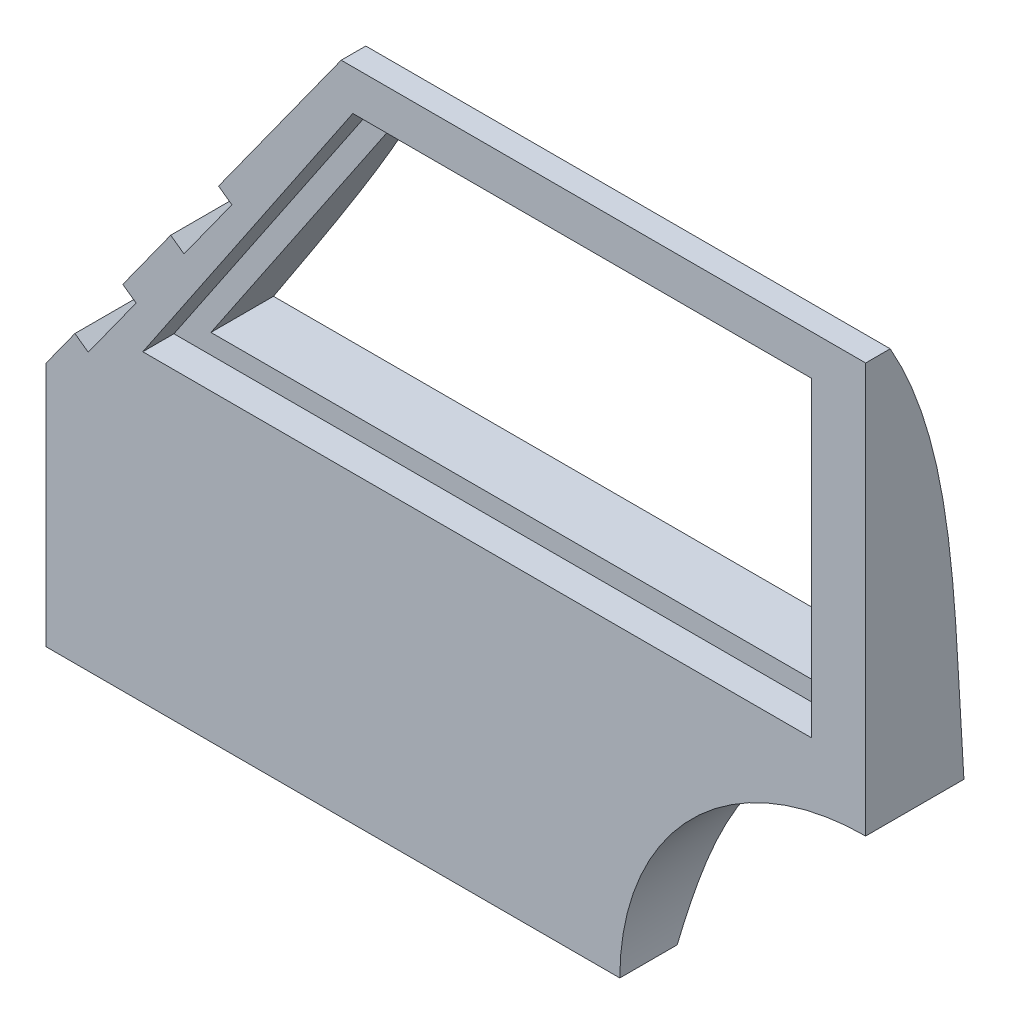
from build123d import *

# Parameters (mm, degrees)
BOSS_EXTRUDE1_DEPTH     = 152.4
CUT_EXTRUDE1_DEPTH      = 1634.518215387
CUT_EXTRUDE1_DEPTH_BACK = 1634.518215387
CUT_EXTRUDE2_DEPTH      = 1634.518215536
FILLET1_R               = 50.8
CUT_EXTRUDE3_DEPTH      = 48.26
CUT_EXTRUDE4_DEPTH      = 1213.010253568
SKETCH6_W               = 101.6
SKETCH6_H               = 127
CUT_EXTRUDE5_DEPTH      = 25.4
LPATTERN1_COUNT         = 2
LPATTERN1_PITCH         = 254
SKETCH7_W               = 304.8
SKETCH7_H               = 127
CUT_EXTRUDE7_DEPTH      = 114.3


with BuildPart() as part:
    # Sketch1 → Boss-Extrude1 (new body)
    with BuildSketch(Plane.XY):
        with BuildLine():
            Line((0, 0), (0, 381))
            Line((0, 381), (457.2, 1016))
            Line((457.2, 1016), (1270, 1016))
            Line((1270, 1016), (1270, 381))
            ThreePointArc((1270, 381), (1000.592316368, 269.407683632), (889, 0))
            Line((889, 0), (0, 0))
        make_face()
    extrude(amount=BOSS_EXTRUDE1_DEPTH)

    # Sketch3 → Cut-Extrude1 (cut, two sides: drawn at the far end of the back side and taken through both)
    with BuildSketch(Plane(origin=(1270, 0, 0), x_dir=(0, 0, -1), z_dir=(1, 0, 0)).offset(-CUT_EXTRUDE1_DEPTH_BACK)):
        with BuildLine():
            Line((0, 1016), (-114.3, 1016))
            add(Edge.make_bspline(
                [(-114.3, 1016), (-8.40924149, 829.104015067), (-15.870449407, 600.128785321), (0, 381)],
                knots=[0, 0, 0, 0, 1, 1, 1, 1], degree=3))
            Line((0, 381), (0, 1016))
        make_face()
    extrude(amount=CUT_EXTRUDE1_DEPTH + CUT_EXTRUDE1_DEPTH_BACK, mode=Mode.SUBTRACT)

    # Sketch4 → Cut-Extrude2 (cut, through all)
    with BuildSketch(Plane.ZY):
        with BuildLine():
            Line((0, 0), (63.5, 0))
            add(Edge.make_bspline(
                [(0, 381), (19.94820776, 253.802921476), (11.059212426, 124.818838522), (63.5, 0)],
                knots=[0, 0, 0, 0, 1, 1, 1, 1], degree=3))
            Line((0, 381), (0, 0))
        make_face()
    extrude(amount=-CUT_EXTRUDE2_DEPTH, mode=Mode.SUBTRACT)

    # Fillet1
    fillet1_edges = [part.edges().sort_by_distance(p)[0] for p in [
        (635, 381, 0),
    ]]
    fillet(fillet1_edges, radius=FILLET1_R)

    # Sketch5 → Cut-Extrude3 (cut)
    with BuildSketch(Plane.XY.offset(152.4)):
        Polygon((1186.404527601, 953.507993358), (1186.404527601, 470.907993358), (149.686717373, 470.907993358), (475.204527601, 953.507993358), align=None)
    extrude(amount=-CUT_EXTRUDE3_DEPTH, mode=Mode.SUBTRACT)

    # 3DSketch1 → Cut-Extrude4 (cut, through all)
    with BuildSketch(Plane(origin=(491.411031078, 923.027993358, 104.14), x_dir=(0.8443699387246085, -0.535760586995909, 0), z_dir=(0, 0, -1))):
        Polygon((0, 0), (-14.240523347, 508.390329239), (786.993314242, 0), (561.095220341, -356.020140964), align=None)
    extrude(amount=CUT_EXTRUDE4_DEPTH, mode=Mode.SUBTRACT)

    # Sketch6 → Cut-Extrude5 (cut)
    with BuildSketch(Plane(origin=(-180.663856691, 130.077976818, 0), x_dir=(0, 0, 1), z_dir=(-0.8115343414514944, 0.5843047258450759, 0))):
        with Locations((101.6, 448.894584093)):
            Rectangle(SKETCH6_W, SKETCH6_H)
    cut_extrude5 = extrude(amount=-CUT_EXTRUDE5_DEPTH, mode=Mode.SUBTRACT)

    # LPattern1: Cut-Extrude5 ×2
    with Locations(*[Vector(0.5843047258450758, 0.8115343414514946, 0) * (i * LPATTERN1_PITCH) for i in range(1, LPATTERN1_COUNT)]):
        add(cut_extrude5, mode=Mode.SUBTRACT)

    # Sketch7 → Cut-Extrude7 (cut)
    with BuildSketch(Plane.XY.offset(-16.17222699)):
        with Locations((800.1, 359.431211457)):
            Rectangle(SKETCH7_W, SKETCH7_H)
    extrude(amount=CUT_EXTRUDE7_DEPTH, mode=Mode.SUBTRACT)


solid = part.part
